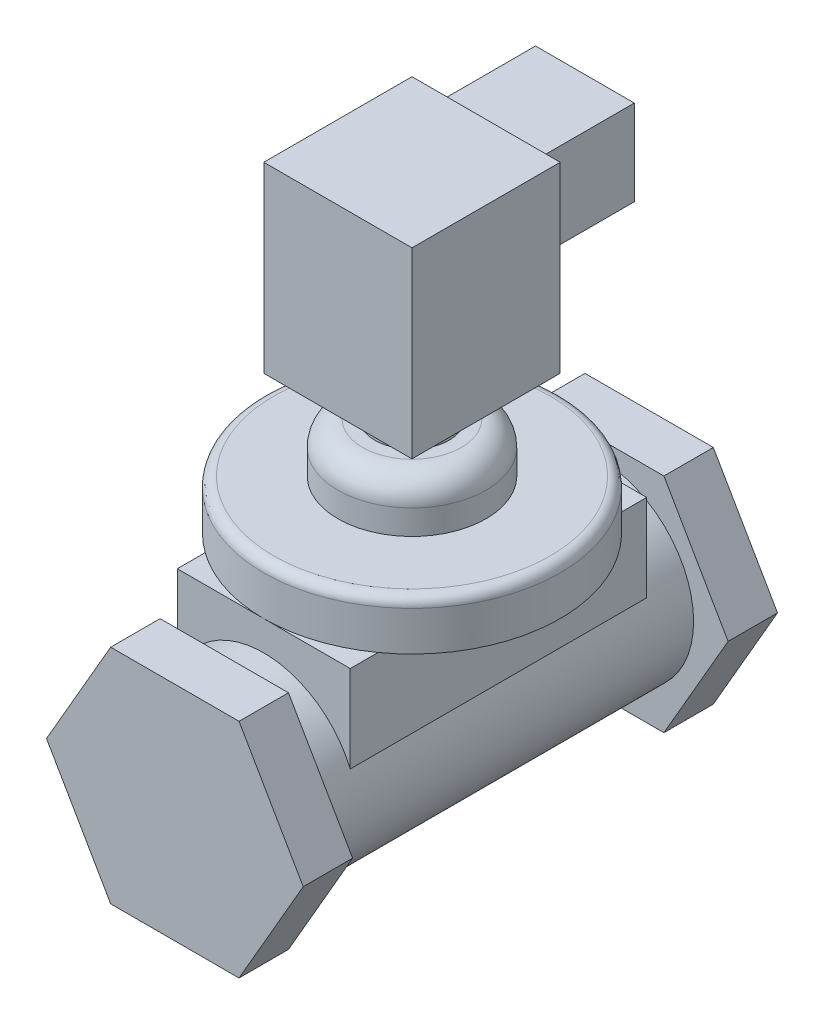
from build123d import *

# Parameters (mm, degrees)
EXTRUDE_1_DEPTH   = 10
SKETCH_2_R        = 19
EXTRUDE_2_DEPTH   = 76
EXTRUDE_3_DEPTH   = 10
SKETCH_4_W        = 35
SKETCH_4_H        = 60
EXTRUDE_4_DEPTH   = 25
SKETCH_5_R        = 30
EXTRUDE_9_DEPTH   = 10
SKETCH_6_R        = 15
EXTRUDE_10_DEPTH  = 10
FILLET_1_R        = 5
SKETCH_7_R        = 7.5
EXTRUDE_11_DEPTH  = 8
SKETCH_8_W        = 30
SKETCH_8_H        = 30
EXTRUDE_12_DEPTH  = 37
FILLET_4_R        = 2
SKETCH_9_W        = 20
SKETCH_9_H        = 17.308382811
EXTRUDE_1_2_DEPTH = 20


with BuildPart() as part:
    # Эскиз1 → Extrude 1 (new body)
    with BuildSketch(Plane.XY):
        Polygon((-25.980762114, 0), (-12.990381057, -22.5), (12.990381057, -22.5), (25.980762114, 0), (12.990381057, 22.5), (-12.990381057, 22.5), align=None)
    extrude(amount=EXTRUDE_1_DEPTH)

    # Эскиз2 → Вытянуть2 (add)
    with BuildSketch(Plane(origin=(0, 0, 0), x_dir=(-1, 0, 0), z_dir=(0, 0, -1))):
        Circle(SKETCH_2_R)
    extrude(amount=EXTRUDE_2_DEPTH)

    # Эскиз3 → Вытянуть3 (add)
    with BuildSketch(Plane(origin=(0, 0, -76), x_dir=(-1, 0, 0), z_dir=(0, 0, -1))):
        Polygon((25.980762114, 0), (12.990381057, 22.5), (-12.990381057, 22.5), (-25.980762114, 0), (-12.990381057, -22.5), (12.990381057, -22.5), align=None)
    extrude(amount=EXTRUDE_3_DEPTH)

    # Эскиз4 → Вытянуть4 (add)
    with BuildSketch(Plane(origin=(0, 0, 0), x_dir=(1, 0, 0), z_dir=(0, 1, 0))):
        with Locations((0, 38)):
            Rectangle(SKETCH_4_W, SKETCH_4_H)
    extrude(amount=EXTRUDE_4_DEPTH)

    # Эскиз5 → Вытянуть9 (add)
    with BuildSketch(Plane(origin=(0, 25, 0), x_dir=(1, 0, 0), z_dir=(0, 1, 0))):
        with Locations((0, 38)):
            Circle(SKETCH_5_R)
    extrude(amount=EXTRUDE_9_DEPTH)

    # Эскиз6 → Вытянуть10 (add)
    with BuildSketch(Plane(origin=(0, 35, 0), x_dir=(1, 0, 0), z_dir=(0, 1, 0))):
        with Locations((0, 38)):
            Circle(SKETCH_6_R)
    extrude(amount=EXTRUDE_10_DEPTH)

    # Скругление1
    fillet_1_edges = [part.edges().sort_by_distance(p)[0] for p in [
        (-15, 45, -38),
    ]]
    fillet(fillet_1_edges, radius=FILLET_1_R)

    # Эскиз7 → Вытянуть11 (add)
    with BuildSketch(Plane(origin=(0, 45, 0), x_dir=(1, 0, 0), z_dir=(0, 1, 0))):
        with Locations((0, 38)):
            Circle(SKETCH_7_R)
    extrude(amount=EXTRUDE_11_DEPTH)

    # Эскиз8 → Вытянуть12 (add)
    with BuildSketch(Plane(origin=(0, 53, 0), x_dir=(1, 0, 0), z_dir=(0, 1, 0))):
        with Locations((0, 38)):
            Rectangle(SKETCH_8_W, SKETCH_8_H)
    extrude(amount=EXTRUDE_12_DEPTH)

    # Скругление4
    fillet_4_edges = [part.edges().sort_by_distance(p)[0] for p in [
        (-30, 35, -38),
    ]]
    fillet(fillet_4_edges, radius=FILLET_4_R)

    # Эскиз9 → Extrude 1 2 (add)
    with BuildSketch(Plane(origin=(0, 0, -53), x_dir=(-1, 0, 0), z_dir=(0, 0, -1))):
        with Locations((0, 79.224035867)):
            Rectangle(SKETCH_9_W, SKETCH_9_H)
    extrude(amount=EXTRUDE_1_2_DEPTH)


solid = part.part
